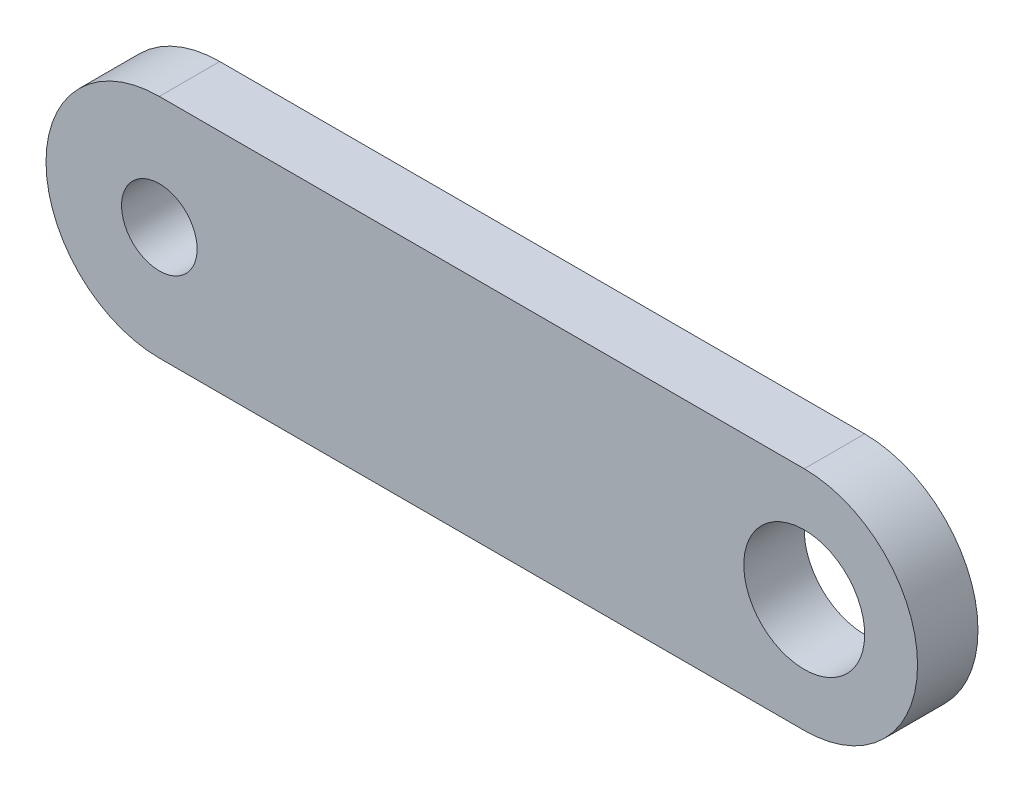
from build123d import *

# Parameters (mm, degrees)
SKETCH1_R           = 4.7625
SKETCH1_R_2         = 1.5875
SKETCH1_R_3         = 2.54
BOSS_EXTRUDE2_DEPTH = 2.54


with BuildPart() as part:
    # Sketch1 → Boss-Extrude2 (new body)
    # profile 1 of 3: a face of its own
    with BuildSketch(Plane.XY):
        Circle(SKETCH1_R)
        Circle(SKETCH1_R_2, mode=Mode.SUBTRACT)
    # profile 2 of 3: a face of its own
    with BuildSketch(Plane.XY):
        with Locations((27.1018, 0)):
            Circle(SKETCH1_R)
        with Locations((27.1018, 0)):
            Circle(SKETCH1_R_3, mode=Mode.SUBTRACT)
    # profile 3 of 3: a face of its own
    with BuildSketch(Plane.XY):
        with BuildLine():
            Line((27.1018, 4.7625), (0, 4.7625))
            ThreePointArc((0, 4.7625), (3.367596045, 3.367596045), (4.7625, 0))
            ThreePointArc((4.7625, 0), (3.367596045, -3.367596045), (0, -4.7625))
            Line((0, -4.7625), (27.1018, -4.7625))
            ThreePointArc((27.1018, -4.7625), (22.3393, 0), (27.1018, 4.7625))
        make_face()
    extrude(amount=BOSS_EXTRUDE2_DEPTH)


solid = part.part
